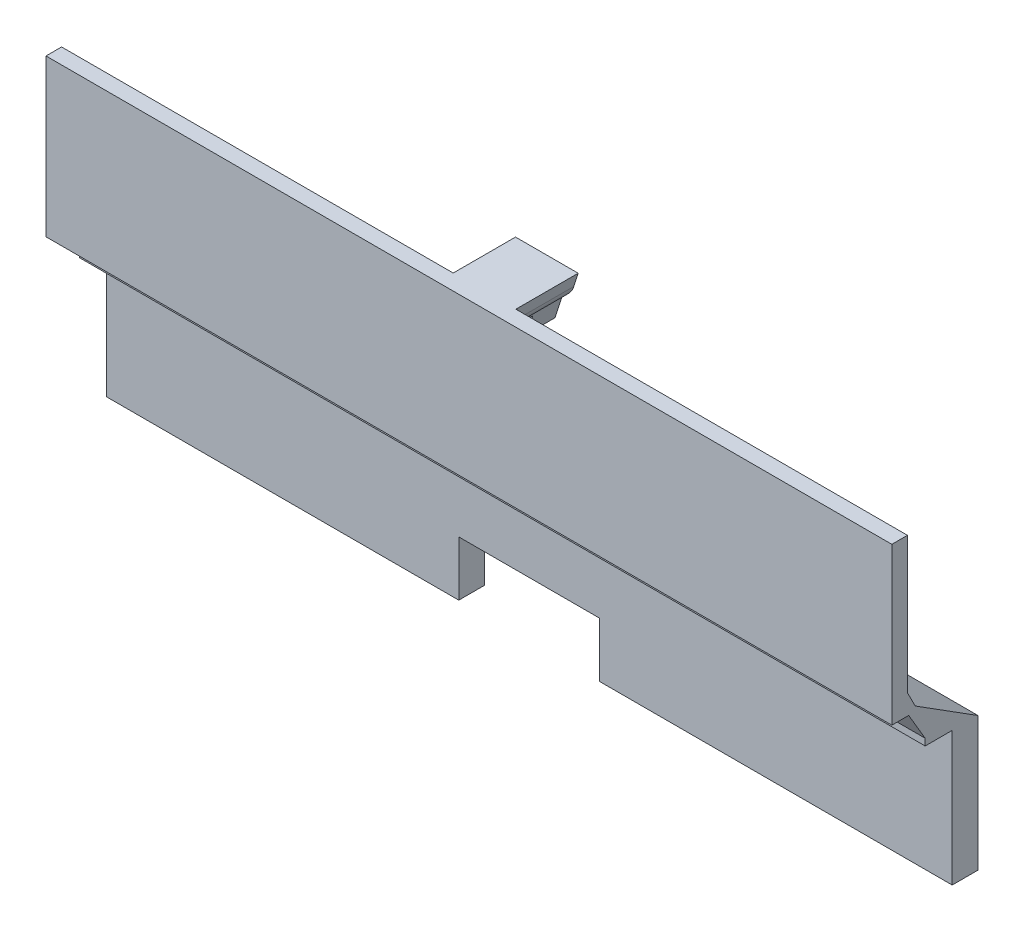
from build123d import *

# Parameters (mm, degrees)
EXTRUDE_1_DEPTH     = 27
SKETCH_2_W          = 9
SKETCH_2_H          = 4
CUT_EXTRUDE_1_DEPTH = 4
SKETCH_3_W          = 9
SKETCH_3_H          = 3.038101075
EXTRUDE_2_DEPTH     = 3
SKETCH_4_R          = 1.5
CUT_EXTRUDE_2_DEPTH = 9
EXTRUDE_3_DEPTH     = 2
CUT_EXTRUDE_8_DEPTH = 3.9


with BuildPart() as part:
    # 草图1 → 凸台-拉伸1 (new, symmetric)
    with BuildSketch(Plane(origin=(0, 0, 0), x_dir=(0, 0, -1), z_dir=(1, 0, 0))):
        Polygon((5.5, -5.234874936), (5.5, -1.276151444), (5.5, 1.303226139), (5.5, 3.316049082), (1.495683541, 5.841749257), (0.996390194, 6.822725158), (0.996390194, 8.881545648), (0.996390194, 13.350016649), (0.996390194, 15.531060696), (0, 15.531060696), (0, 13.265125064), (0, 9.02431695), (0, 5.531060696), (1.075983727, 5.531060696), (2.127060271, 3.7449116), (2.127060271, 3.316049082), (3.852001832, 3.316049082), (3.852001832, -5.234874936), align=None)
    extrude(amount=EXTRUDE_1_DEPTH, both=True)

    # 草图2 → 切除-拉伸1 (cut)
    with BuildSketch(Plane(origin=(0, 0, -5.5), x_dir=(-1, 0, 0), z_dir=(0, 0, -1))):
        with Locations((0, -3.734874936)):
            Rectangle(SKETCH_2_W, SKETCH_2_H)
    extrude(amount=-CUT_EXTRUDE_1_DEPTH, mode=Mode.SUBTRACT)

    # 草图3 → 凸台-拉伸2 (add)
    with BuildSketch(Plane(origin=(0, 0, -5.5), x_dir=(-1, 0, 0), z_dir=(0, 0, -1))):
        with Locations((0, -0.215824399)):
            Rectangle(SKETCH_3_W, SKETCH_3_H)
    extrude(amount=EXTRUDE_2_DEPTH)

    # 草图4 → 切除-拉伸2 (cut)
    with BuildSketch(Plane.XZ.offset(1.734874936)):
        with Locations(Location((0, -6.102001832, 0), (0, 0, 270))):
            Circle(SKETCH_4_R)
    extrude(amount=-CUT_EXTRUDE_2_DEPTH, mode=Mode.SUBTRACT)

    # 草图6 → 凸台-拉伸3 (add, symmetric)
    with BuildSketch(Plane(origin=(0, 0, 0), x_dir=(0, 0, -1), z_dir=(1, 0, 0))):
        Polygon((0.975132856, 15.531060696), (4.975132856, 15.531060696), (4.975132856, 12.331060696), (3.175132856, 12.331060696), (3.175132856, 13.531060696), (2.0593477, 13.531060696), (0.975132856, 13.531060696), align=None)
    extrude(amount=EXTRUDE_3_DEPTH, both=True)

    # 草图7 → 切除-拉伸8 (cut)
    with BuildSketch(Plane(origin=(0, 0, -4.975132856), x_dir=(-1, 0, 0), z_dir=(0, 0, -1))):
        with BuildLine():
            Line((1, 13.831060696), (0.52341558, 12.331060696))
            Line((0.52341558, 12.331060696), (2, 12.331060696))
            Line((2, 12.331060696), (2, 15.531060696))
            Line((2, 15.531060696), (1.723060875, 14.659423543))
            ThreePointArc((1.723060875, 14.659423543), (1.447645575, 14.170073989), (1, 13.831060696))
        make_face()
        with BuildLine():
            ThreePointArc((-1.723060875, 14.659423543), (-1.447645575, 14.170073989), (-1, 13.831060696))
            Line((-1, 13.831060696), (-0.52341558, 12.331060696))
            Line((-0.52341558, 12.331060696), (-2, 12.331060696))
            Line((-2, 12.331060696), (-2, 15.531060696))
            Line((-2, 15.531060696), (-1.723060875, 14.659423543))
        make_face()
    extrude(amount=-CUT_EXTRUDE_8_DEPTH, mode=Mode.SUBTRACT)


solid = part.part
